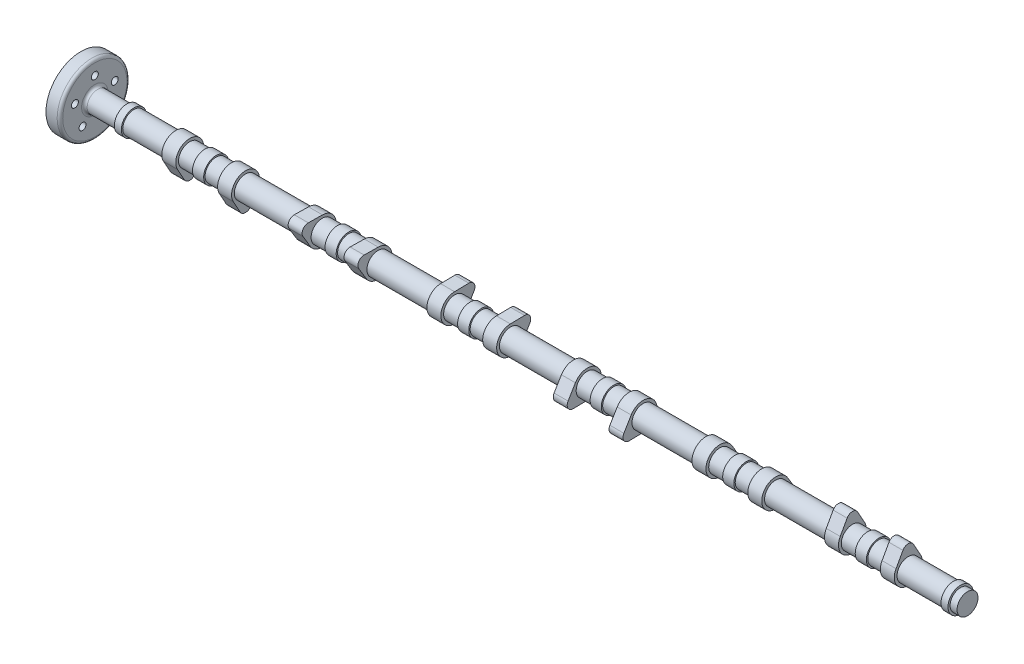
from build123d import *

# Parameters (mm, degrees)
SKETCH1_R             = 8
BOSS_EXTRUDE1_DEPTH   = 47.5
BOSS_EXTRUDE2_START   = 15
BOSS_EXTRUDE2_DEPTH   = 10
SKETCH3_R             = 9
BOSS_EXTRUDE3_DEPTH   = 4
LPATTERN1_COUNT       = 6
LPATTERN1_PITCH       = 95
BODY_MOVE_COPY1_ANGLE = 60
BODY_MOVE_COPY2_ANGLE = 120
BODY_MOVE_COPY3_ANGLE = 60
BODY_MOVE_COPY4_ANGLE = 120
BODY_MOVE_COPY5_ANGLE = 180
BOSS_EXTRUDE4_START   = 10
SKETCH4_R             = 8
BOSS_EXTRUDE4_DEPTH   = 10
BOSS_EXTRUDE5_START   = 5
SKETCH5_R             = 9
BOSS_EXTRUDE5_DEPTH   = 5
SKETCH6_R             = 7.5
BOSS_EXTRUDE6_DEPTH   = 5
SKETCH7_R             = 8
BOSS_EXTRUDE7_DEPTH   = 7.5
SKETCH8_R             = 9
BOSS_EXTRUDE8_DEPTH   = 5
BOSS_EXTRUDE9_START   = 23
SKETCH9_R             = 7.5
BOSS_EXTRUDE9_DEPTH   = 23
SKETCH10_R            = 25
SKETCH10_R_2          = 2.5
BOSS_EXTRUDE10_DEPTH  = 10
FILLET1_R             = 2
CUT_EXTRUDE1_REACH    = 638.483
SKETCH11_R            = 2.5


with BuildPart() as part:
    # Sketch1 → Boss-Extrude1 (new, symmetric)
    with BuildSketch(Plane(origin=(0, 0, 0), x_dir=(0, 0, -1), z_dir=(1, 0, 0))):
        Circle(SKETCH1_R)
    extrude(amount=BOSS_EXTRUDE1_DEPTH, both=True)

    # Sketch2 → Boss-Extrude2 (add)
    with BuildSketch(Plane(origin=(0, 0, 0), x_dir=(0, 0, -1), z_dir=(1, 0, 0)).offset(BOSS_EXTRUDE2_START)):
        with BuildLine():
            Line((-3.807936598, -13.756953924), (-8.746197071, -4.848096202))
            ThreePointArc((-8.746197071, -4.848096202), (0, 10), (8.746197071, -4.848096202))
            Line((8.746197071, -4.848096202), (3.807936598, -13.756953924))
            ThreePointArc((3.807936598, -13.756953924), (0, -16), (-3.807936598, -13.756953924))
        make_face()
    boss_extrude2 = extrude(amount=BOSS_EXTRUDE2_DEPTH)

    # Mirror1: Boss-Extrude2 across plane
    add(boss_extrude2.mirror(Plane(origin=(0, 0, 0), x_dir=(0, 0, 1), z_dir=(1, 0, 0))))

    # Sketch3 → Boss-Extrude3 (add, symmetric)
    with BuildSketch(Plane(origin=(0, 0, 0), x_dir=(0, 0, -1), z_dir=(1, 0, 0))):
        Circle(SKETCH3_R)
    extrude(amount=BOSS_EXTRUDE3_DEPTH, both=True)


with BuildPart() as lpattern1_1:
    # LPattern1: pattern copy
    add(part.part.moved(Location(Vector(1, 0, 0) * (1 * LPATTERN1_PITCH))))


with BuildPart() as lpattern1_2:
    # LPattern1: pattern copy
    add(part.part.moved(Location(Vector(1, 0, 0) * (2 * LPATTERN1_PITCH))))


with BuildPart() as lpattern1_3:
    # LPattern1: pattern copy
    add(part.part.moved(Location(Vector(1, 0, 0) * (3 * LPATTERN1_PITCH))))


with BuildPart() as lpattern1_4:
    # LPattern1: pattern copy
    add(part.part.moved(Location(Vector(1, 0, 0) * (4 * LPATTERN1_PITCH))))


with BuildPart() as lpattern1_5:
    # LPattern1: pattern copy
    add(part.part.moved(Location(Vector(1, 0, 0) * (5 * LPATTERN1_PITCH))))


with BuildPart() as lpattern1_3_1:
    # Body-Move/Copy1: moved
    add(lpattern1_3.part.rotate(Axis((0, 0, 0), (-1, 0, 0)), BODY_MOVE_COPY1_ANGLE))


with BuildPart() as lpattern1_1_1:
    # Body-Move/Copy2: moved
    add(lpattern1_1.part.rotate(Axis((0, 0, 0), (-1, 0, 0)), BODY_MOVE_COPY2_ANGLE))


with BuildPart() as lpattern1_4_1:
    # Body-Move/Copy3: moved
    add(lpattern1_4.part.rotate(Axis((0, 0, 0), (1, 0, 0)), BODY_MOVE_COPY3_ANGLE))


with BuildPart() as lpattern1_2_1:
    # Body-Move/Copy4: moved
    add(lpattern1_2.part.rotate(Axis((0, 0, 0), (1, 0, 0)), BODY_MOVE_COPY4_ANGLE))


with BuildPart() as lpattern1_5_1:
    # Body-Move/Copy5: moved
    add(lpattern1_5.part.rotate(Axis((0, 0, 0), (1, 0, 0)), BODY_MOVE_COPY5_ANGLE))

    # Sketch4 → Boss-Extrude4 (add)
    with BuildSketch(Plane(origin=(522.5, 0, 0), x_dir=(0, 0, -1), z_dir=(1, 0, 0)).offset(BOSS_EXTRUDE4_START)):
        Circle(SKETCH4_R)
    extrude(amount=-BOSS_EXTRUDE4_DEPTH)

    # Sketch5 → Boss-Extrude5 (add)
    with BuildSketch(Plane(origin=(532.5, 0, 0), x_dir=(0, 0, -1), z_dir=(1, 0, 0)).offset(BOSS_EXTRUDE5_START)):
        Circle(SKETCH5_R)
    extrude(amount=-BOSS_EXTRUDE5_DEPTH)


with BuildPart() as part_1:
    add(part.part)

    # Combine1: union LPattern1_1, LPattern1_2, LPattern1_3, LPattern1_4, LPattern1_5
    add(lpattern1_1_1.part)
    add(lpattern1_2_1.part)
    add(lpattern1_3_1.part)
    add(lpattern1_4_1.part)
    add(lpattern1_5_1.part)

    # Sketch6 → Boss-Extrude6 (add)
    with BuildSketch(Plane(origin=(537.5, 0, 0), x_dir=(0, 0, -1), z_dir=(1, 0, 0))):
        Circle(SKETCH6_R)
    extrude(amount=BOSS_EXTRUDE6_DEPTH)

    # Sketch7 → Boss-Extrude7 (add)
    with BuildSketch(Plane.ZY.offset(47.5)):
        Circle(SKETCH7_R)
    extrude(amount=BOSS_EXTRUDE7_DEPTH)

    # Sketch8 → Boss-Extrude8 (add)
    with BuildSketch(Plane.ZY.offset(55)):
        Circle(SKETCH8_R)
    extrude(amount=BOSS_EXTRUDE8_DEPTH)

    # Sketch9 → Boss-Extrude9 (add)
    with BuildSketch(Plane.ZY.offset(60).offset(BOSS_EXTRUDE9_START)):
        Circle(SKETCH9_R)
    extrude(amount=-BOSS_EXTRUDE9_DEPTH)

    # Sketch10 → Boss-Extrude10 (add)
    with BuildSketch(Plane.ZY.offset(83)):
        Circle(SKETCH10_R)
        Circle(SKETCH10_R_2, mode=Mode.SUBTRACT)
    extrude(amount=BOSS_EXTRUDE10_DEPTH)

    # Fillet1
    fillet1_edges = [part_1.edges().sort_by_distance(p)[0] for p in [
        (-83, 0, -25),
        (-83, 0, -7.5),
    ]]
    fillet(fillet1_edges, radius=FILLET1_R)

    # Sketch11 → Cut-Extrude1 (cut, up to next)
    with BuildSketch(Plane.ZY.offset(93), mode=Mode.PRIVATE) as cut_extrude1_sk1:
        with Locations((0, 15)):
            Circle(SKETCH11_R)
    cut_extrude1_tool1 = extrude(cut_extrude1_sk1.sketch, amount=-CUT_EXTRUDE1_REACH, mode=Mode.PRIVATE) & part_1.part
    # Sketch11 → Cut-Extrude1 (cut, up to next)
    with BuildSketch(Plane.ZY.offset(93), mode=Mode.PRIVATE) as cut_extrude1_sk2:
        with Locations((14.265847744, 4.635254916)):
            Circle(SKETCH11_R)
    cut_extrude1_tool2 = extrude(cut_extrude1_sk2.sketch, amount=-CUT_EXTRUDE1_REACH, mode=Mode.PRIVATE) & part_1.part
    # Sketch11 → Cut-Extrude1 (cut, up to next)
    with BuildSketch(Plane.ZY.offset(93), mode=Mode.PRIVATE) as cut_extrude1_sk3:
        with Locations((8.816778784, -12.135254916)):
            Circle(SKETCH11_R)
    cut_extrude1_tool3 = extrude(cut_extrude1_sk3.sketch, amount=-CUT_EXTRUDE1_REACH, mode=Mode.PRIVATE) & part_1.part
    # Sketch11 → Cut-Extrude1 (cut, up to next)
    with BuildSketch(Plane.ZY.offset(93), mode=Mode.PRIVATE) as cut_extrude1_sk4:
        with Locations((-8.816778784, -12.135254916)):
            Circle(SKETCH11_R)
    cut_extrude1_tool4 = extrude(cut_extrude1_sk4.sketch, amount=-CUT_EXTRUDE1_REACH, mode=Mode.PRIVATE) & part_1.part
    # Sketch11 → Cut-Extrude1 (cut, up to next)
    with BuildSketch(Plane.ZY.offset(93), mode=Mode.PRIVATE) as cut_extrude1_sk5:
        with Locations((-14.265847744, 4.635254916)):
            Circle(SKETCH11_R)
    cut_extrude1_tool5 = extrude(cut_extrude1_sk5.sketch, amount=-CUT_EXTRUDE1_REACH, mode=Mode.PRIVATE) & part_1.part
    add(cut_extrude1_tool1.solids().sort_by_distance((-93, 15, 0))[0], mode=Mode.SUBTRACT)
    add(cut_extrude1_tool2.solids().sort_by_distance((-93, 4.635255, 14.265848))[0], mode=Mode.SUBTRACT)
    add(cut_extrude1_tool3.solids().sort_by_distance((-93, -12.135255, 8.816779))[0], mode=Mode.SUBTRACT)
    add(cut_extrude1_tool4.solids().sort_by_distance((-93, -12.135255, -8.816779))[0], mode=Mode.SUBTRACT)
    add(cut_extrude1_tool5.solids().sort_by_distance((-93, 4.635255, -14.265848))[0], mode=Mode.SUBTRACT)


solid = part_1.part
